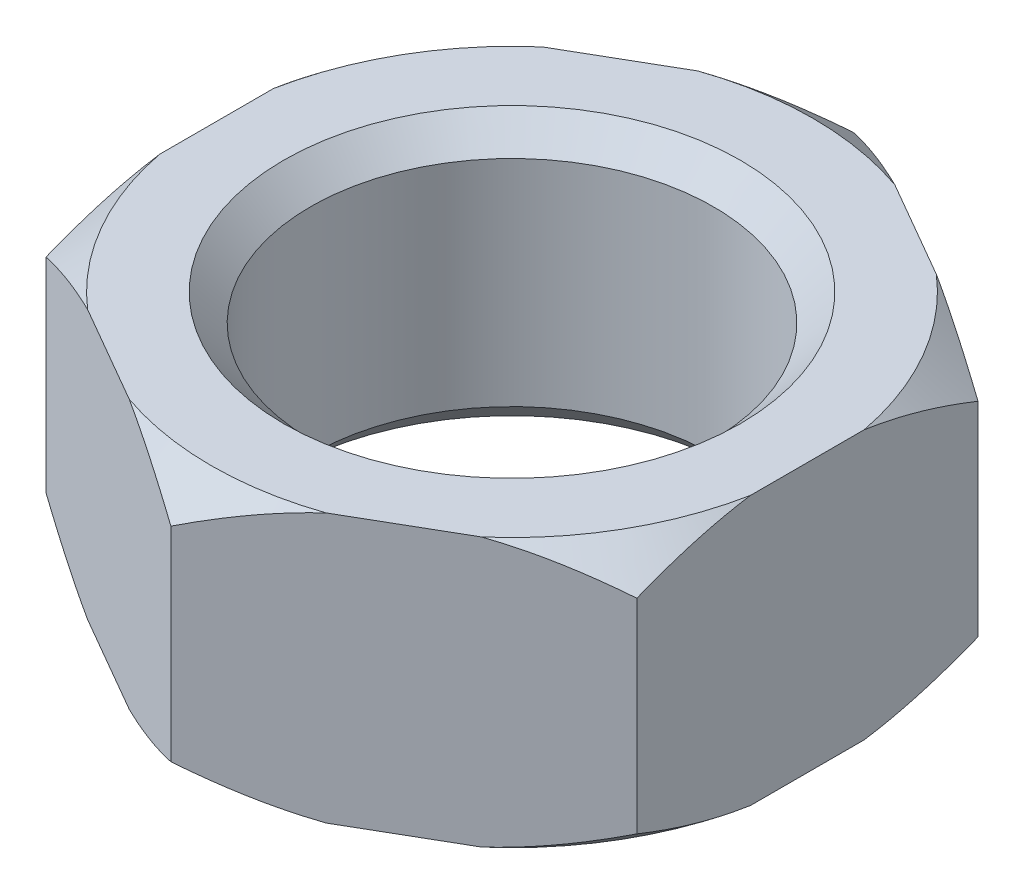
from build123d import *

# Parameters (mm, degrees)
BOSS_EXTRUDE1_DEPTH = 10
SKETCH2_R           = 7.5
CUT_EXTRUDE1_DEPTH  = 20.553345835
CHAMFER1_SIZE       = 1


with BuildPart() as part:
    # Sketch1 → Boss-Extrude1 (new body)
    with BuildSketch(Plane(origin=(0, 0, 0), x_dir=(1, 0, 0), z_dir=(0, 1, 0))):
        Polygon((0, 12.701705922), (-11, 6.350852961), (-11, -6.350852961), (0, -12.701705922), (11, -6.350852961), (11, 6.350852961), align=None)
    extrude(amount=BOSS_EXTRUDE1_DEPTH)

    # Sketch2 → Cut-Extrude1 (cut, through all)
    with BuildSketch(Plane(origin=(0, 10, 0), x_dir=(1, 0, 0), z_dir=(0, 1, 0))):
        with Locations(Location((0, 0, 0), (0, 0, 270))):
            Circle(SKETCH2_R)
    extrude(amount=-CUT_EXTRUDE1_DEPTH, mode=Mode.SUBTRACT)

    # Chamfer1
    chamfer1_edges = [part.edges().sort_by_distance(p)[0] for p in [
        (0, 0, -7.5),
        (0, 10, -7.5),
    ]]
    chamfer(chamfer1_edges, length=CHAMFER1_SIZE)

    # Sketch3 → Cut-Revolve1 (revolve, cut)
    with BuildSketch(Plane(origin=(0, 0, 0), x_dir=(0, 0, -1), z_dir=(1, 0, 0))):
        Polygon((-12.701705922, 10), (-12.701705922, 8.8), (-11.201705922, 10), align=None)
        Polygon((-12.701705922, 0), (-12.701705922, 1.2), (-11.201705922, 0), align=None)
    revolve(axis=Axis((0, 13.381495363, 0), (0, -1, 0)), mode=Mode.SUBTRACT)


solid = part.part
